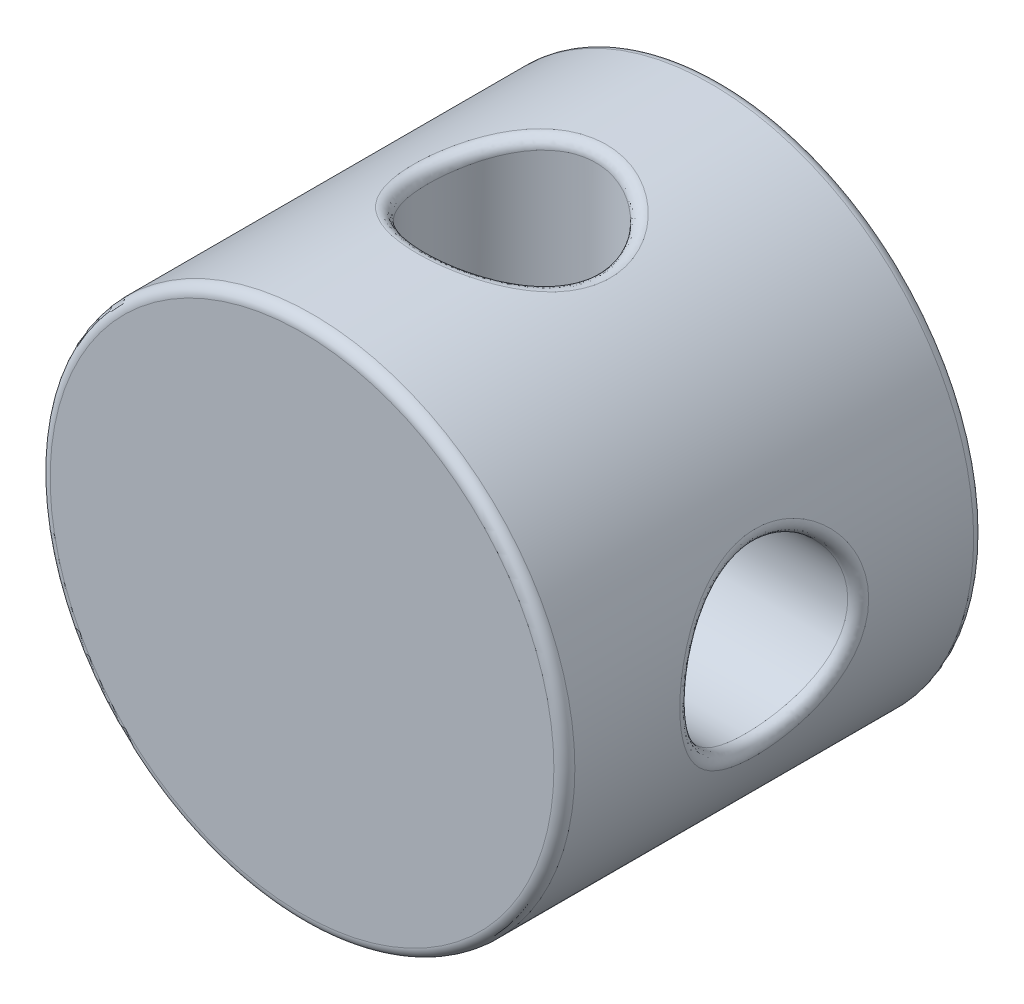
from build123d import *

# Parameters (mm, degrees)
SKETCH20_R          = 25
BOSS_EXTRUDE6_DEPTH = 40
SKETCH21_R          = 8
CUT_EXTRUDE2_DEPTH  = 26
CIRPATTERN1_COUNT   = 2
CIRPATTERN1_ANGLE   = 90
FILLET5_R           = 1


with BuildPart() as part:
    # Sketch20 → Boss-Extrude6 (new body)
    with BuildSketch(Plane.XY.offset(150)):
        with Locations((200, 200)):
            Circle(SKETCH20_R)
    extrude(amount=-BOSS_EXTRUDE6_DEPTH)

    # Sketch21 → Cut-Extrude2 (cut)
    with BuildSketch(Plane(origin=(0, 210, 0), x_dir=(1, 0, 0), z_dir=(0, 1, 0))):
        with Locations((200, -130)):
            Circle(SKETCH21_R)
    cut_extrude2 = extrude(amount=CUT_EXTRUDE2_DEPTH, mode=Mode.SUBTRACT)

    # CirPattern1: Cut-Extrude2 ×2 about axis
    cirpattern1_axis = Axis((200, 200, 110), (0, 0, -1))
    for i in range(1, CIRPATTERN1_COUNT):
        add(cut_extrude2.rotate(cirpattern1_axis, i * CIRPATTERN1_ANGLE / (CIRPATTERN1_COUNT - 1)), mode=Mode.SUBTRACT)

    # Fillet5
    fillet5_edges = [part.edges().sort_by_distance(p)[0] for p in [
        (223.685438565, 208, 130),
        (192, 223.685438565, 130),
        (175, 200, 110),
        (175, 200, 150),
    ]]
    fillet(fillet5_edges, radius=FILLET5_R)


solid = part.part
